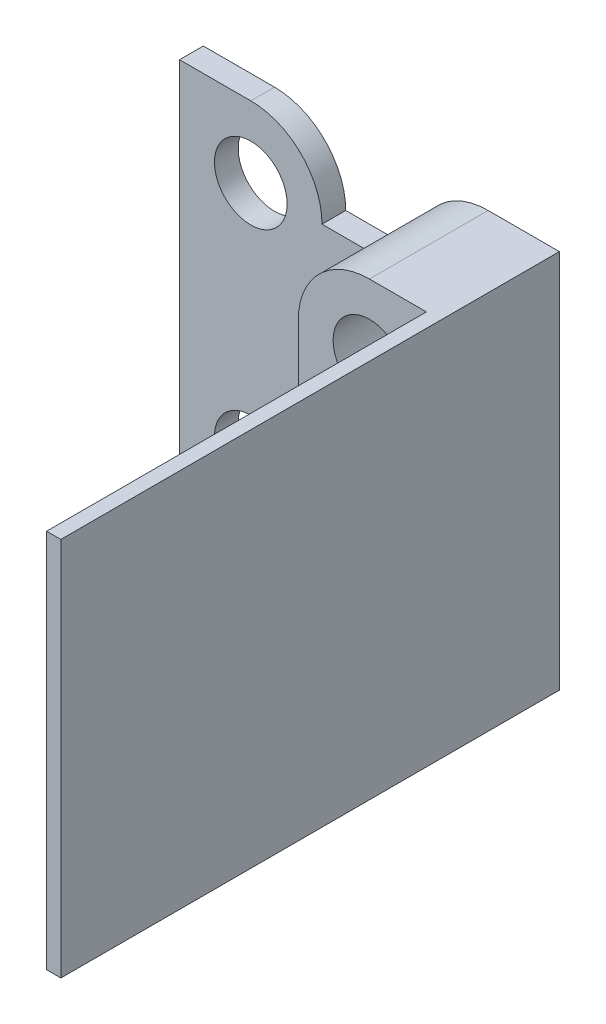
from build123d import *

# Parameters (mm, degrees)
SKETCH1_R           = 7.65
BOSS_EXTRUDE2_DEPTH = 5
SKETCH2_W           = 3
SKETCH2_H           = 80
BOSS_EXTRUDE3_DEPTH = 100
SKETCH3_R           = 7.65
BOSS_EXTRUDE4_DEPTH = 20


with BuildPart() as part:
    # Sketch1 → Boss-Extrude2 (new body)
    with BuildSketch(Plane.XY):
        with BuildLine():
            Line((-15, 65), (0, 65))
            ThreePointArc((0, 65), (10.606601718, 60.606601718), (15, 50))
            Line((15, 50), (30, 50))
            ThreePointArc((30, 50), (34.393398282, 60.606601718), (45, 65))
            Line((45, 65), (60, 65))
            Line((60, 65), (60, 41.966335985))
            Line((60, 41.966335985), (60, -15))
            Line((60, -15), (12.652076701, -15))
            Line((12.652076701, -15), (-15, -15))
            Line((-15, -15), (-15, 65))
        make_face()
        Circle(SKETCH1_R, mode=Mode.SUBTRACT)
        with Locations((45, 50)):
            Circle(SKETCH1_R, mode=Mode.SUBTRACT)
        with Locations((0, 50)):
            Circle(SKETCH1_R, mode=Mode.SUBTRACT)
    extrude(amount=BOSS_EXTRUDE2_DEPTH)

    # Sketch2 → Boss-Extrude3 (add)
    with BuildSketch(Plane.XY.offset(5)):
        with Locations((58.5, 25)):
            Rectangle(SKETCH2_W, SKETCH2_H)
    extrude(amount=BOSS_EXTRUDE3_DEPTH)

    # Sketch3 → Boss-Extrude4 (add)
    with BuildSketch(Plane.XY.offset(5)):
        with BuildLine():
            Line((30, 50), (30, 35))
            Line((30, 35), (57, 35))
            Line((57, 35), (57, 65))
            Line((57, 65), (45, 65))
            ThreePointArc((45, 65), (34.393398282, 60.606601718), (30, 50))
        make_face()
        with Locations((45, 50)):
            Circle(SKETCH3_R, mode=Mode.SUBTRACT)
    extrude(amount=BOSS_EXTRUDE4_DEPTH)


solid = part.part
